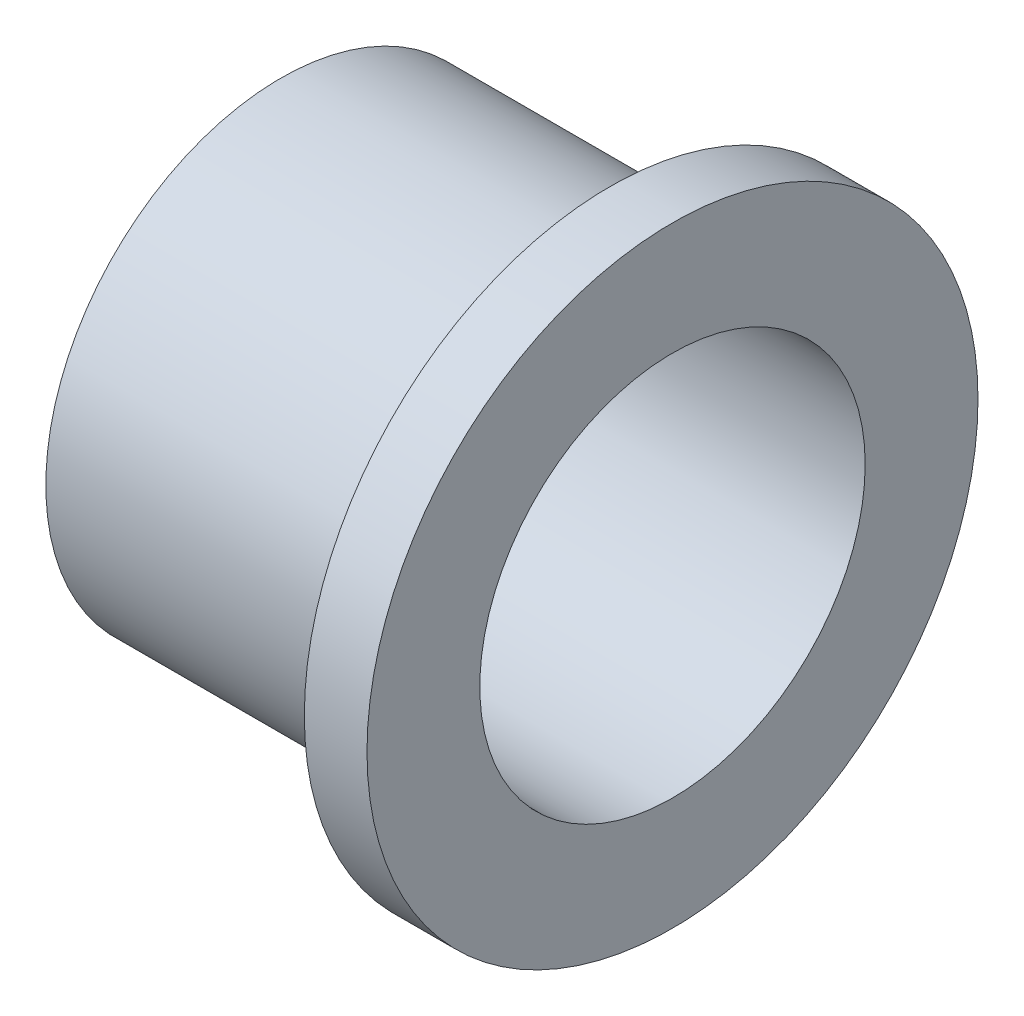
from build123d import *

# Parameters (mm, degrees)
SKETCH_1_R      = 3
SKETCH_1_R_2    = 2.46
EXTRUDE_1_DEPTH = 5
EXTRUDE_START   = -0.8
SKETCH_2_R      = 3.9
SKETCH_2_R_2    = 2.46
EXTRUDE_2_DEPTH = 0.8


with BuildPart() as part:
    # 草图1 → 凸台-拉伸1 (new body)
    with BuildSketch(Plane(origin=(0, 0, 0), x_dir=(0, 0, -1), z_dir=(1, 0, 0))):
        Circle(SKETCH_1_R)
        Circle(SKETCH_1_R_2, mode=Mode.SUBTRACT)
    extrude(amount=EXTRUDE_1_DEPTH)

    # 草图2 → 凸台-拉伸2 (add)
    with BuildSketch(Plane(origin=(5, 0, 0), x_dir=(0, 0, -1), z_dir=(1, 0, 0)).offset(EXTRUDE_START)):
        Circle(SKETCH_2_R)
        Circle(SKETCH_2_R_2, mode=Mode.SUBTRACT)
    extrude(amount=EXTRUDE_2_DEPTH)


solid = part.part
